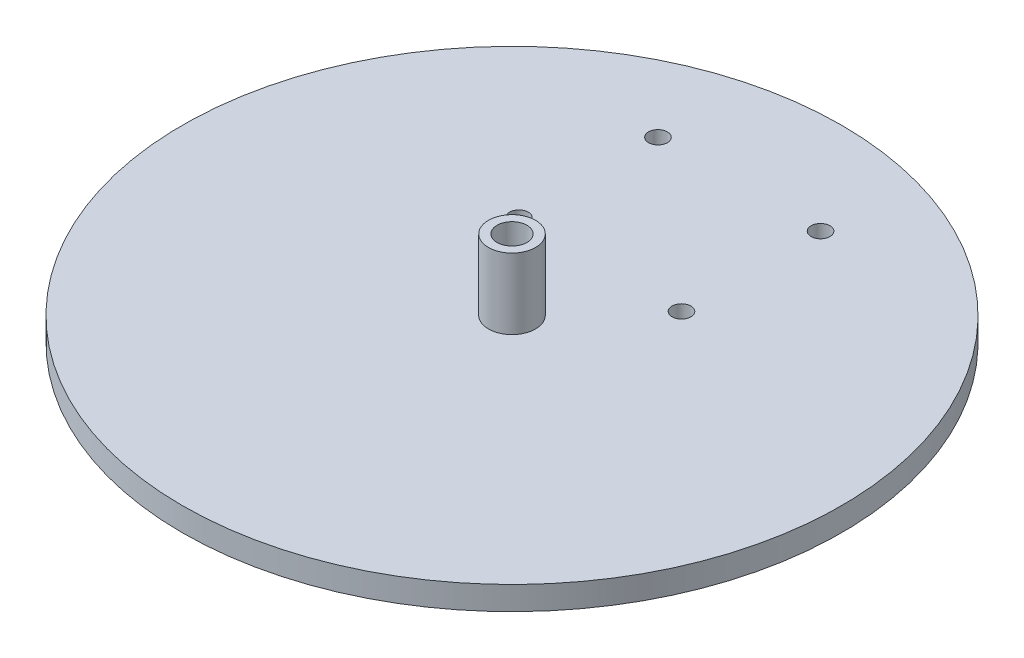
from build123d import *

# Parameters (mm, degrees)
SKETCH1_R           = 70
SKETCH1_R_2         = 3.175
BOSS_EXTRUDE2_DEPTH = 5
SKETCH2_R           = 5
SKETCH2_R_2         = 3.175
BOSS_EXTRUDE4_DEPTH = 15
SKETCH3_R           = 2
CUT_EXTRUDE1_DEPTH  = 10


with BuildPart() as part:
    # Sketch1 → Boss-Extrude2 (new body)
    with BuildSketch(Plane(origin=(0, 0, 0), x_dir=(1, 0, 0), z_dir=(0, 1, 0))):
        with Locations(Location((0, 0, 0), (0, 0, 270))):
            Circle(SKETCH1_R)
        with Locations(Location((0, 0, 0), (0, 0, 270))):
            Circle(SKETCH1_R_2, mode=Mode.SUBTRACT)
    extrude(amount=BOSS_EXTRUDE2_DEPTH)

    # Sketch2 → Boss-Extrude4 (add)
    with BuildSketch(Plane(origin=(0, 5, 0), x_dir=(1, 0, 0), z_dir=(0, 1, 0))):
        with Locations(Location((0, 0, 0), (0, 0, 270))):
            Circle(SKETCH2_R)
        with Locations(Location((0, 0, 0), (0, 0, 270))):
            Circle(SKETCH2_R_2, mode=Mode.SUBTRACT)
    extrude(amount=BOSS_EXTRUDE4_DEPTH)

    # Sketch3 → Cut-Extrude1 (cut)
    with BuildSketch(Plane(origin=(0, 5, 0), x_dir=(1, 0, 0), z_dir=(0, 1, 0))):
        with Locations(Location((-17.267766953, 48.267766953, 0), (0, 0, 270))):
            Circle(SKETCH3_R)
        with Locations(Location((17.267766953, 48.267766953, 0), (0, 0, 270))):
            Circle(SKETCH3_R)
        with Locations(Location((-17.267766953, 18.732233047, 0), (0, 0, 270))):
            Circle(SKETCH3_R)
        with Locations(Location((17.267766953, 18.732233047, 0), (0, 0, 270))):
            Circle(SKETCH3_R)
    extrude(amount=-CUT_EXTRUDE1_DEPTH, mode=Mode.SUBTRACT)


solid = part.part
